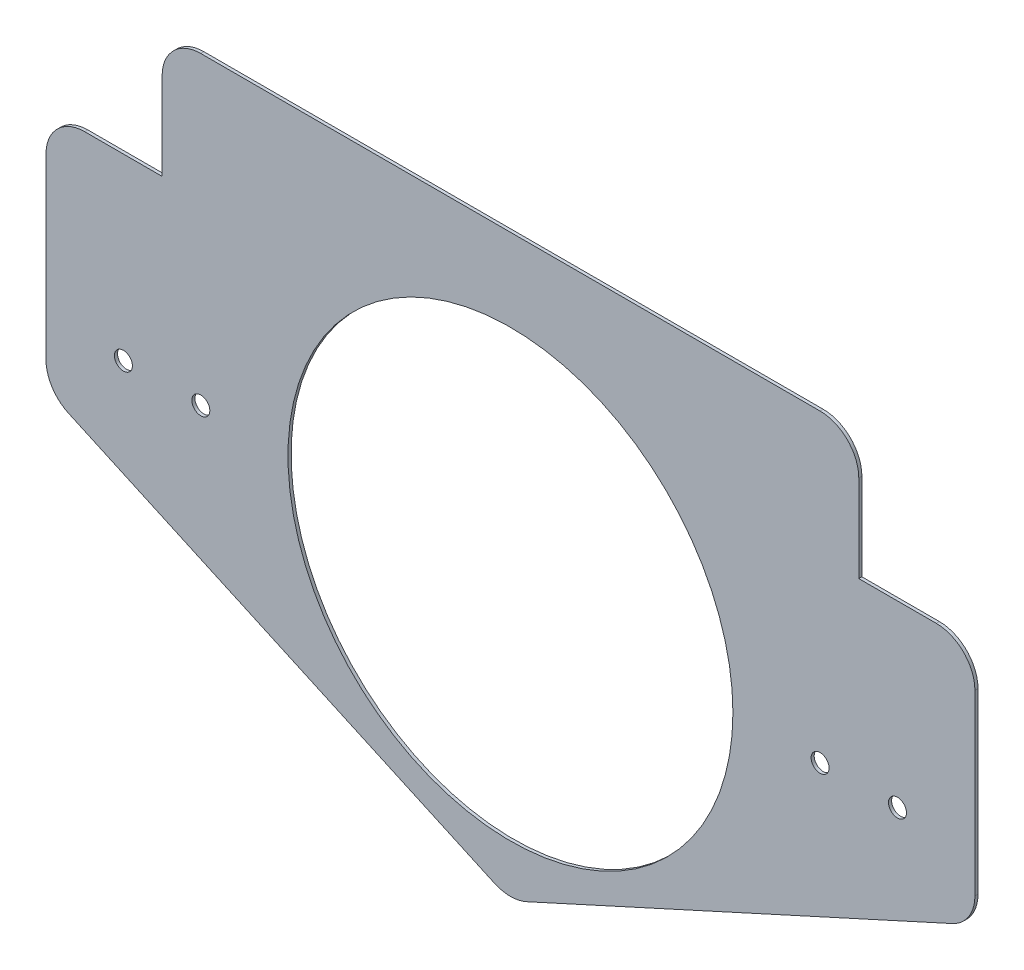
from build123d import *

# Parameters (mm, degrees)
SKETCH2_R           = 1.475
SKETCH2_R_2         = 36.5
SKETCH2_W           = 19.05
SKETCH2_H           = 25.4
SKETCH2_H_2         = 7.933333334
BOSS_EXTRUDE1_DEPTH = 0.508
FILLET1_R           = 6.35


with BuildPart() as part:
    # Sketch2 → Boss-Extrude1 (new body)
    # profile 1 of 7: a face of its own
    with BuildSketch(Plane.XY):
        Polygon((57.15, 50), (-57.15, 50), (-57.15, 29.366666667), (-57.15, 3.966666667), (-57.15, -3.966666667), (-57.15, -18.966666667), (0, -45), (57.15, -18.966666667), (57.15, -3.966666667), (57.15, 3.966666667), (57.15, 29.366666667), align=None)
        with Locations((-50.8, 0)):
            Circle(SKETCH2_R, mode=Mode.SUBTRACT)
        Circle(SKETCH2_R_2, mode=Mode.SUBTRACT)
        with Locations((50.8, 0)):
            Circle(SKETCH2_R, mode=Mode.SUBTRACT)
    # profile 2 of 7: a face of its own
    with BuildSketch(Plane.XY):
        with Locations((-66.675, 16.666666667)):
            Rectangle(SKETCH2_W, SKETCH2_H)
    # profile 3 of 7: a face of its own
    with BuildSketch(Plane.XY):
        with Locations((-66.675, 0)):
            Rectangle(SKETCH2_W, SKETCH2_H_2)
        with Locations((-63.5, 0)):
            Circle(SKETCH2_R, mode=Mode.SUBTRACT)
    # profile 4 of 7: a face of its own
    with BuildSketch(Plane.XY):
        Polygon((-57.15, -18.966666667), (-57.15, -3.966666667), (-76.2, -3.966666667), (-76.2, -10.288888889), align=None)
    # profile 5 of 7: a face of its own
    with BuildSketch(Plane.XY):
        Polygon((76.2, -3.966666667), (57.15, -3.966666667), (57.15, -18.966666667), (76.2, -10.288888889), align=None)
    # profile 6 of 7: a face of its own
    with BuildSketch(Plane.XY):
        with Locations((66.675, 0)):
            Rectangle(SKETCH2_W, SKETCH2_H_2)
        with Locations((63.5, 0)):
            Circle(SKETCH2_R, mode=Mode.SUBTRACT)
    # profile 7 of 7: a face of its own
    with BuildSketch(Plane.XY):
        with Locations((66.675, 16.666666667)):
            Rectangle(SKETCH2_W, SKETCH2_H)
    extrude(amount=BOSS_EXTRUDE1_DEPTH)

    # Fillet1
    fillet1_edges = [part.edges().sort_by_distance(p)[0] for p in [
        (0, -45, 0.254),
        (-76.2, -10.288888889, 0.254),
        (-76.2, 29.366666667, 0.254),
        (-57.15, 50, 0.254),
        (57.15, 50, 0.254),
        (76.2, 29.366666667, 0.254),
        (76.2, -10.288888889, 0.254),
    ]]
    fillet(fillet1_edges, radius=FILLET1_R)


solid = part.part
